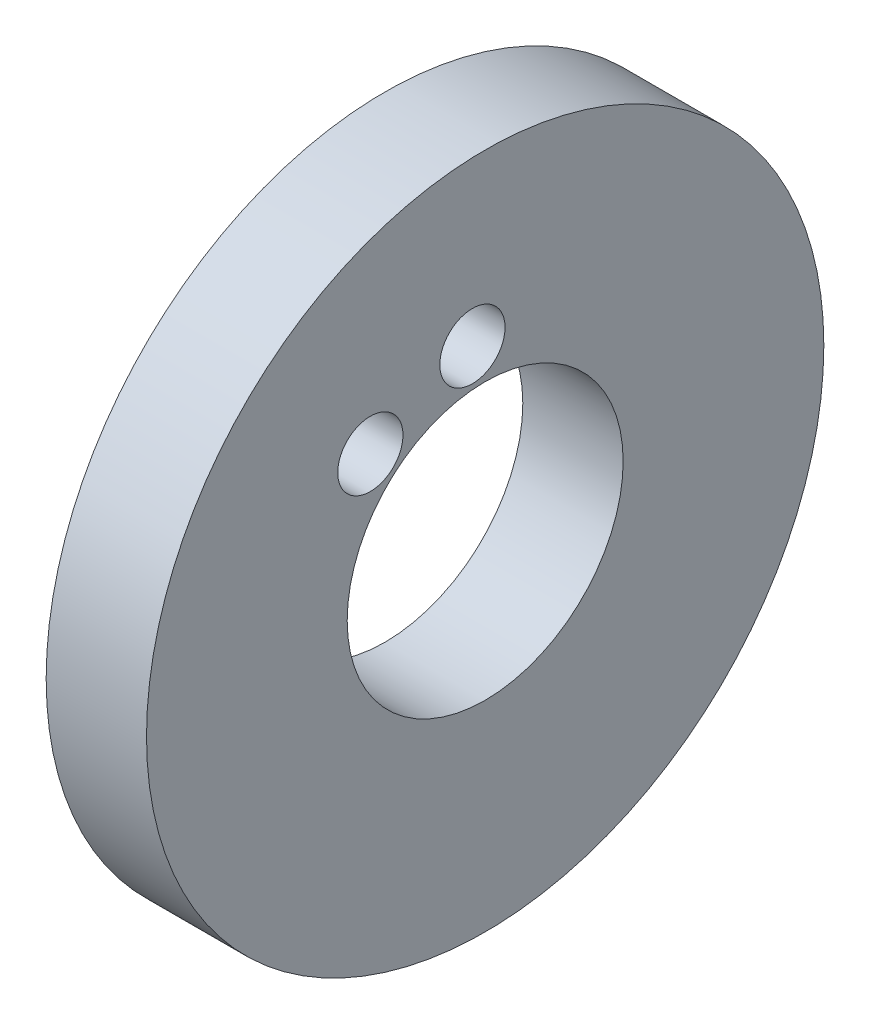
from build123d import *

# Parameters (mm, degrees)
AXIAL_PROFILE_MM_W     = 8
AXIAL_PROFILE_MM_H     = 16
AXIAL_HOLES_DEPTH      = 149.686549493
AXIAL_HOLES_DEPTH_BACK = 149.686549493
SKETCH2_R              = 2.6


with BuildPart() as part:
    # Axial profile (mm) → Full revolution (revolve)
    with BuildSketch(Plane.XY, mode=Mode.PRIVATE) as full_revolution_sk:
        with Locations((139.7, 19)):
            Rectangle(AXIAL_PROFILE_MM_W, AXIAL_PROFILE_MM_H)
    revolve(full_revolution_sk.sketch.rotate(Axis((-110, 0, 0), (1, 0, 0)), 90), axis=Axis((-110, 0, 0), (1, 0, 0)))

    # Sketch2 → Axial holes (cut, two sides: drawn at the far end of the back side and taken through both)
    with BuildSketch(Plane(origin=(0, 0, 0), x_dir=(0, 0, -1), z_dir=(1, 0, 0)).offset(-AXIAL_HOLES_DEPTH_BACK)):
        with Locations((-1.016890853, 13.963020196)):
            Circle(SKETCH2_R)
        with Locations((-9.154295848, 10.592396684)):
            Circle(SKETCH2_R)
    extrude(amount=AXIAL_HOLES_DEPTH + AXIAL_HOLES_DEPTH_BACK, mode=Mode.SUBTRACT)


solid = part.part
